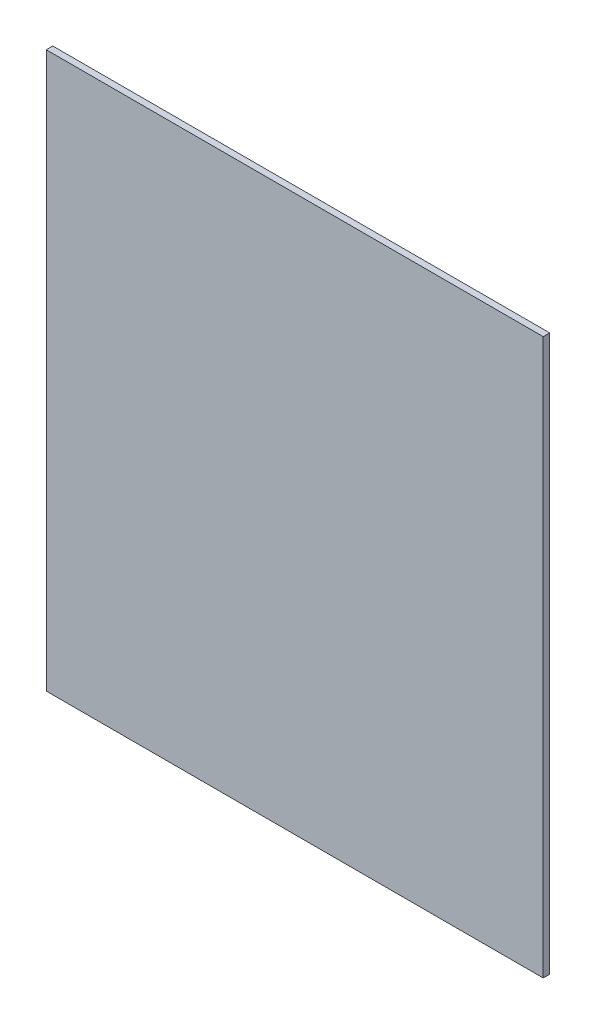
from build123d import *

# Parameters (mm, degrees)
SKETCH1_W           = 153
SKETCH1_H           = 171
BOSS_EXTRUDE1_DEPTH = 2


with BuildPart() as part:
    # Sketch1 → Boss-Extrude1 (new body)
    with BuildSketch(Plane.XY):
        Rectangle(SKETCH1_W, SKETCH1_H)
    extrude(amount=BOSS_EXTRUDE1_DEPTH)


solid = part.part
